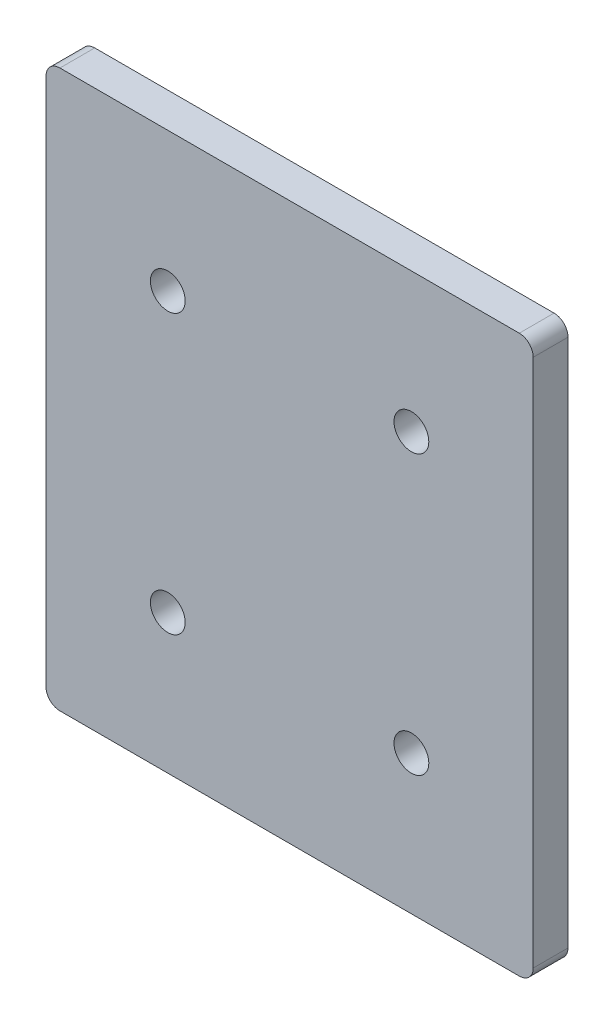
from build123d import *

# Parameters (mm, degrees)
SKETCH2_W           = 70
SKETCH2_H           = 80
SKETCH2_R           = 2.5
BOSS_EXTRUDE1_DEPTH = 5
FILLET1_R           = 2


with BuildPart() as part:
    # Sketch2 → Boss-Extrude1 (new body)
    with BuildSketch(Plane.XY):
        Rectangle(SKETCH2_W, SKETCH2_H)
        with Locations((-17.5, 20)):
            Circle(SKETCH2_R, mode=Mode.SUBTRACT)
        with Locations((17.5, 20)):
            Circle(SKETCH2_R, mode=Mode.SUBTRACT)
        with Locations((17.5, -20)):
            Circle(SKETCH2_R, mode=Mode.SUBTRACT)
        with Locations((-17.5, -20)):
            Circle(SKETCH2_R, mode=Mode.SUBTRACT)
    extrude(amount=BOSS_EXTRUDE1_DEPTH)

    # Fillet1
    fillet1_edges = [part.edges().sort_by_distance(p)[0] for p in [
        (35, -40, 2.5),
        (-35, -40, 2.5),
        (-35, 40, 2.5),
        (35, 40, 2.5),
    ]]
    fillet(fillet1_edges, radius=FILLET1_R)


solid = part.part
